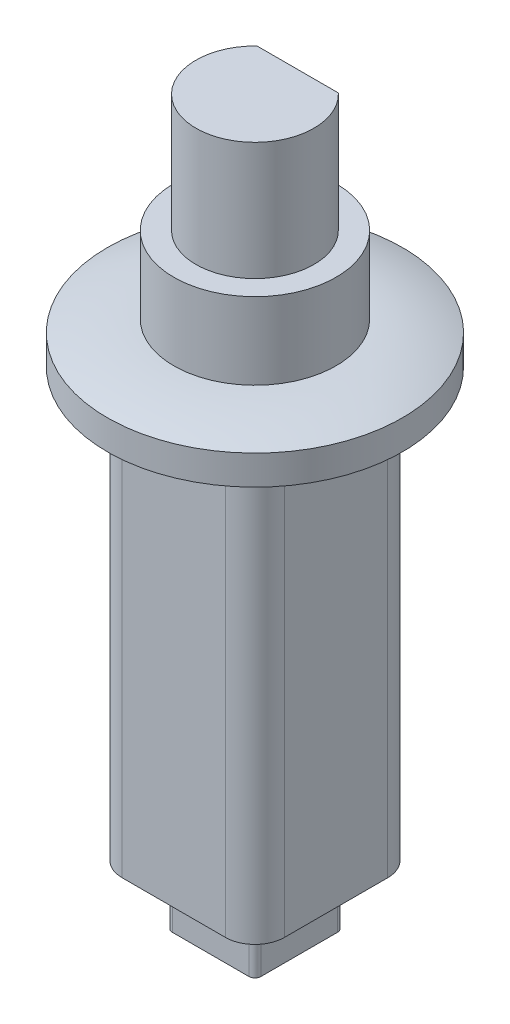
from build123d import *

# Parameters (mm, degrees)
CUT_EXTRUDE1_START  = -4
CUT_EXTRUDE1_DEPTH  = 4
BOSS_EXTRUDE1_DEPTH = 14.5
BOSS_EXTRUDE2_DEPTH = 2


with BuildPart() as part:
    # Sketch1 → Revolve1 (revolve)
    with BuildSketch(Plane.XY, mode=Mode.PRIVATE) as revolve1_sk:
        with BuildLine():
            Line((0, 8), (2, 8))
            Line((2, 8), (2, 4))
            Line((2, 4), (2.75, 4))
            Line((2.75, 4), (2.75, 1.4))
            ThreePointArc((2.75, 1.4), (3.892639488, 1.299222121), (5, 1))
            Line((5, 1), (5, 0))
            Line((5, 0), (0, 0))
            Line((0, 0), (0, 8))
        make_face()
    revolve(revolve1_sk.sketch.rotate(Axis((0, 8, 0), (0, -1, 0)), 180), axis=Axis((0, 8, 0), (0, -1, 0)))

    # Sketch2 → Cut-Extrude1 (cut)
    with BuildSketch(Plane(origin=(0, 8, 0), x_dir=(1, 0, 0), z_dir=(0, 1, 0)).offset(CUT_EXTRUDE1_START)):
        with BuildLine():
            Line((-1.377497731, 1.45), (1.377497731, 1.45))
            ThreePointArc((1.377497731, 1.45), (0, 2), (-1.377497731, 1.45))
        make_face()
    extrude(amount=CUT_EXTRUDE1_DEPTH, mode=Mode.SUBTRACT)

    # Sketch3 → Boss-Extrude1 (add)
    with BuildSketch(Plane.XZ):
        with BuildLine():
            Line((-1.75, -2.75), (1.75, -2.75))
            ThreePointArc((1.75, -2.75), (2.457106781, -2.457106781), (2.75, -1.75))
            Line((2.75, -1.75), (2.75, 1.75))
            ThreePointArc((2.75, 1.75), (2.457106781, 2.457106781), (1.75, 2.75))
            Line((1.75, 2.75), (-1.75, 2.75))
            ThreePointArc((-1.75, 2.75), (-2.457106781, 2.457106781), (-2.75, 1.75))
            Line((-2.75, 1.75), (-2.75, -1.75))
            ThreePointArc((-2.75, -1.75), (-2.457106781, -2.457106781), (-1.75, -2.75))
        make_face()
    extrude(amount=BOSS_EXTRUDE1_DEPTH)

    # Sketch5 → Boss-Extrude2 (add)
    with BuildSketch(Plane.XZ.offset(14.5)):
        with BuildLine():
            Line((1.3, -1.5), (-1.3, -1.5))
            ThreePointArc((-1.3, -1.5), (-1.441421356, -1.441421356), (-1.5, -1.3))
            Line((-1.5, -1.3), (-1.5, 1.3))
            ThreePointArc((-1.5, 1.3), (-1.441421356, 1.441421356), (-1.3, 1.5))
            Line((-1.3, 1.5), (1.3, 1.5))
            ThreePointArc((1.3, 1.5), (1.441421356, 1.441421356), (1.5, 1.3))
            Line((1.5, 1.3), (1.5, -1.3))
            ThreePointArc((1.5, -1.3), (1.441421356, -1.441421356), (1.3, -1.5))
        make_face()
    extrude(amount=BOSS_EXTRUDE2_DEPTH)


solid = part.part
